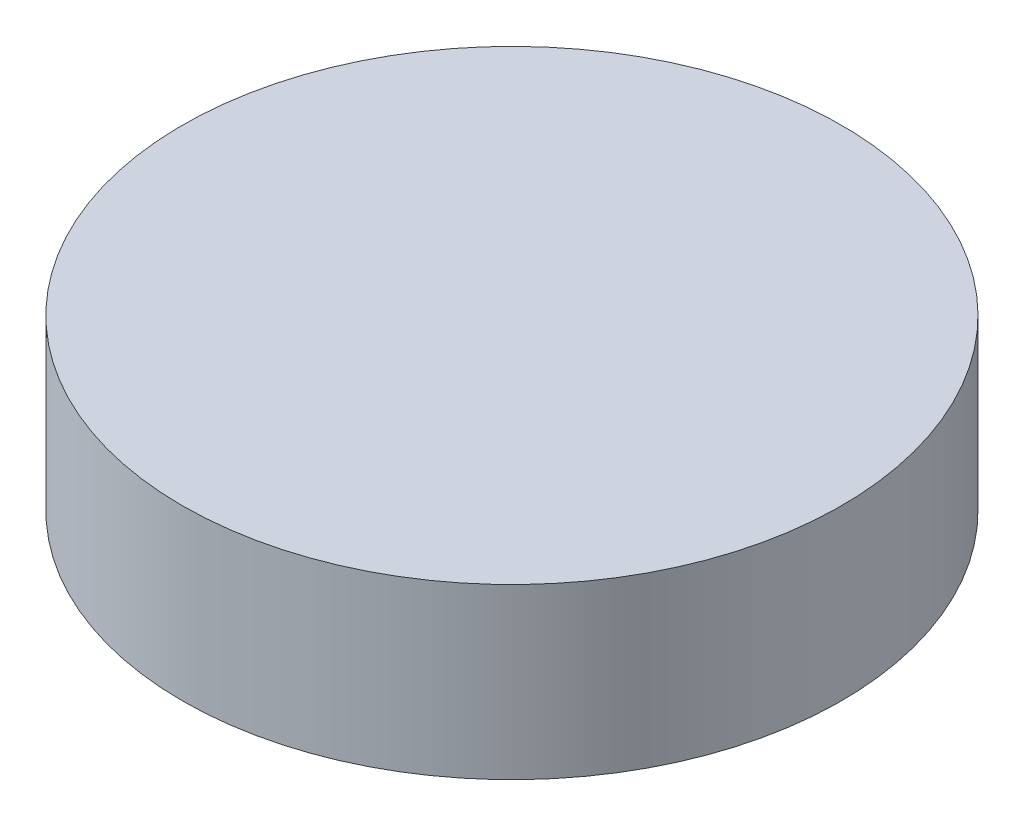
from build123d import *

# Parameters (mm, degrees)
SKETCH1_R           = 19.5
BOSS_EXTRUDE1_DEPTH = 10


with BuildPart() as part:
    # Sketch1 → Boss-Extrude1 (new body)
    with BuildSketch(Plane(origin=(0, 0, 0), x_dir=(1, 0, 0), z_dir=(0, 1, 0))):
        with Locations(Location((0, 0, 0), (0, 0, 270))):
            Circle(SKETCH1_R)
    extrude(amount=BOSS_EXTRUDE1_DEPTH)


solid = part.part
